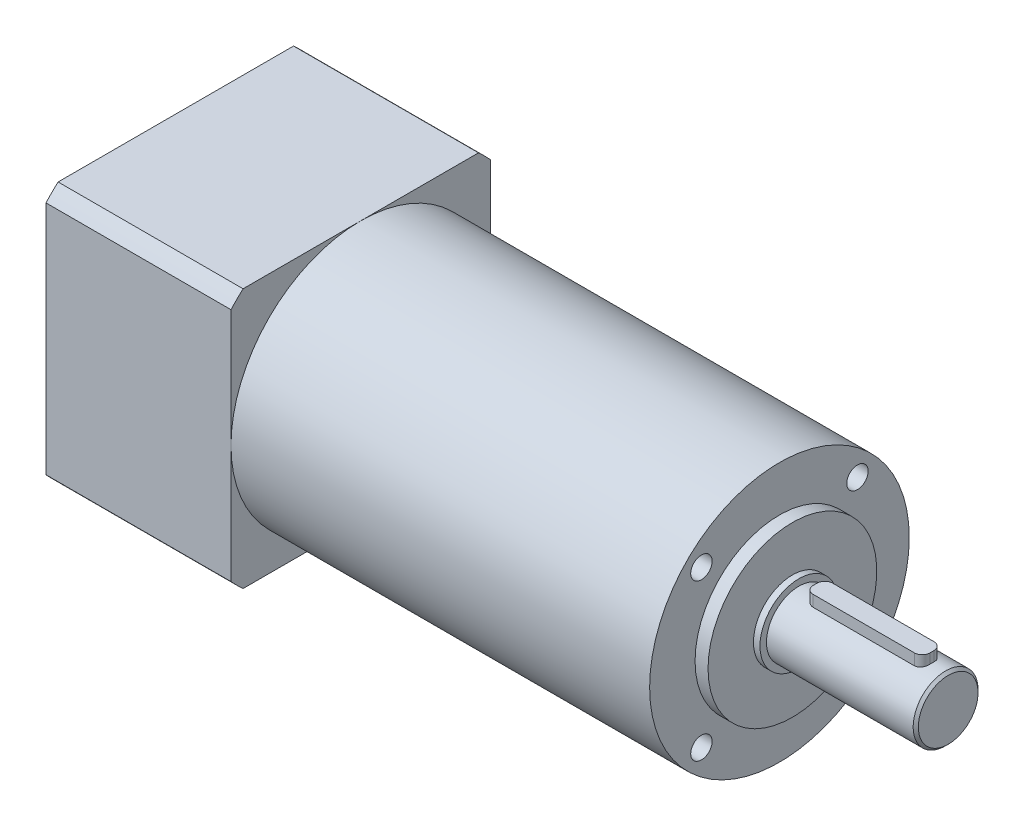
from build123d import *

# Parameters (mm, degrees)
M4_TAPPED_HOLE1_D     = 3.3
M4_TAPPED_HOLE1_DEPTH = 6
M4_TAPPED_HOLE1_TIP   = 0.991420021
SKETCH6_W             = 40
SKETCH6_H             = 40
BOSS_EXTRUDE1_DEPTH   = 28.5
CUT_EXTRUDE1_REACH    = 124.315
CIRPATTERN1_COUNT     = 4
CHAMFER1_SIZE         = 0.4
BOSS_EXTRUDE2_DEPTH   = 1.5


with BuildPart() as part:
    # Sketch1 → Revolve1 (revolve)
    with BuildSketch(Plane.XY, mode=Mode.PRIVATE) as revolve1_sk:
        Polygon((0, 0), (0, 20), (64.5, 20), (64.5, 13), (66.5, 13), (66.5, 6), (67.5, 6), (67.5, 5), (90.5, 5), (90.5, 0), align=None)
    revolve(revolve1_sk.sketch.rotate(Axis((0, 0, 0), (1, 0, 0)), 90), axis=Axis((0, 0, 0), (1, 0, 0)))

    # M4 Tapped Hole1
    with Locations(Plane(origin=(64.5, 0, 0), x_dir=(0, 0, -1), z_dir=(1, 0, 0))):
        with Locations((12.02081528, -12.02081528), (12.02081528, 12.02081528), (-12.02081528, -12.02081528), (-12.02081528, 12.02081528)):
            Hole(M4_TAPPED_HOLE1_D / 2, depth=M4_TAPPED_HOLE1_DEPTH)
            with Locations((0, 0, -(M4_TAPPED_HOLE1_DEPTH + M4_TAPPED_HOLE1_TIP / 2))):  # 118° drill point
                Cone(0, M4_TAPPED_HOLE1_D / 2, M4_TAPPED_HOLE1_TIP, mode=Mode.SUBTRACT)

    # Sketch6 → Boss-Extrude1 (add)
    with BuildSketch(Plane.ZY):
        Rectangle(SKETCH6_W, SKETCH6_H)
    extrude(amount=BOSS_EXTRUDE1_DEPTH)

    # Sketch7 → Cut-Extrude1 (cut, up to next)
    with BuildSketch(Plane.ZY.offset(28.5), mode=Mode.PRIVATE) as cut_extrude1_sk1:
        with BuildLine():
            Line((-20, 20), (-20, 18.138357147))
            ThreePointArc((-20, 18.138357147), (-19.091883092, 19.091883092), (-18.138357147, 20))
            Line((-18.138357147, 20), (-20, 20))
        make_face()
    cut_extrude1_tool1 = extrude(cut_extrude1_sk1.sketch, amount=-CUT_EXTRUDE1_REACH, mode=Mode.PRIVATE) & part.part
    cut_extrude1 = cut_extrude1_tool1.solids().sort_by_distance((-28.5, 19.389578, -19.389578))[0]
    add(cut_extrude1, mode=Mode.SUBTRACT)

    # CirPattern1: Cut-Extrude1 ×4 about axis
    cirpattern1_axis = Axis((0, 0, 0), (-1, 0, 0))
    for i in range(1, CIRPATTERN1_COUNT):
        add(cut_extrude1.rotate(cirpattern1_axis, i * 360 / CIRPATTERN1_COUNT), mode=Mode.SUBTRACT)

    # Chamfer1
    chamfer1_edges = [part.edges().sort_by_distance(p)[0] for p in [
        (90.5, 0, -5),
    ]]
    chamfer(chamfer1_edges, length=CHAMFER1_SIZE)

    # Sketch8 → Boss-Extrude2 (add, symmetric)
    with BuildSketch(Plane(origin=(0, 5, 0), x_dir=(1, 0, 0), z_dir=(0, 1, 0))):
        with BuildLine():
            Line((71.2, 1.5), (86.8, 1.5))
            ThreePointArc((86.8, 1.5), (87.648528137, 1.148528137), (88, 0.3))
            Line((88, 0.3), (88, -0.3))
            ThreePointArc((88, -0.3), (87.648528137, -1.148528137), (86.8, -1.5))
            Line((86.8, -1.5), (71.2, -1.5))
            ThreePointArc((71.2, -1.5), (70.351471863, -1.148528137), (70, -0.3))
            Line((70, -0.3), (70, 0.3))
            ThreePointArc((70, 0.3), (70.351471863, 1.148528137), (71.2, 1.5))
        make_face()
    extrude(amount=BOSS_EXTRUDE2_DEPTH, both=True)


solid = part.part
